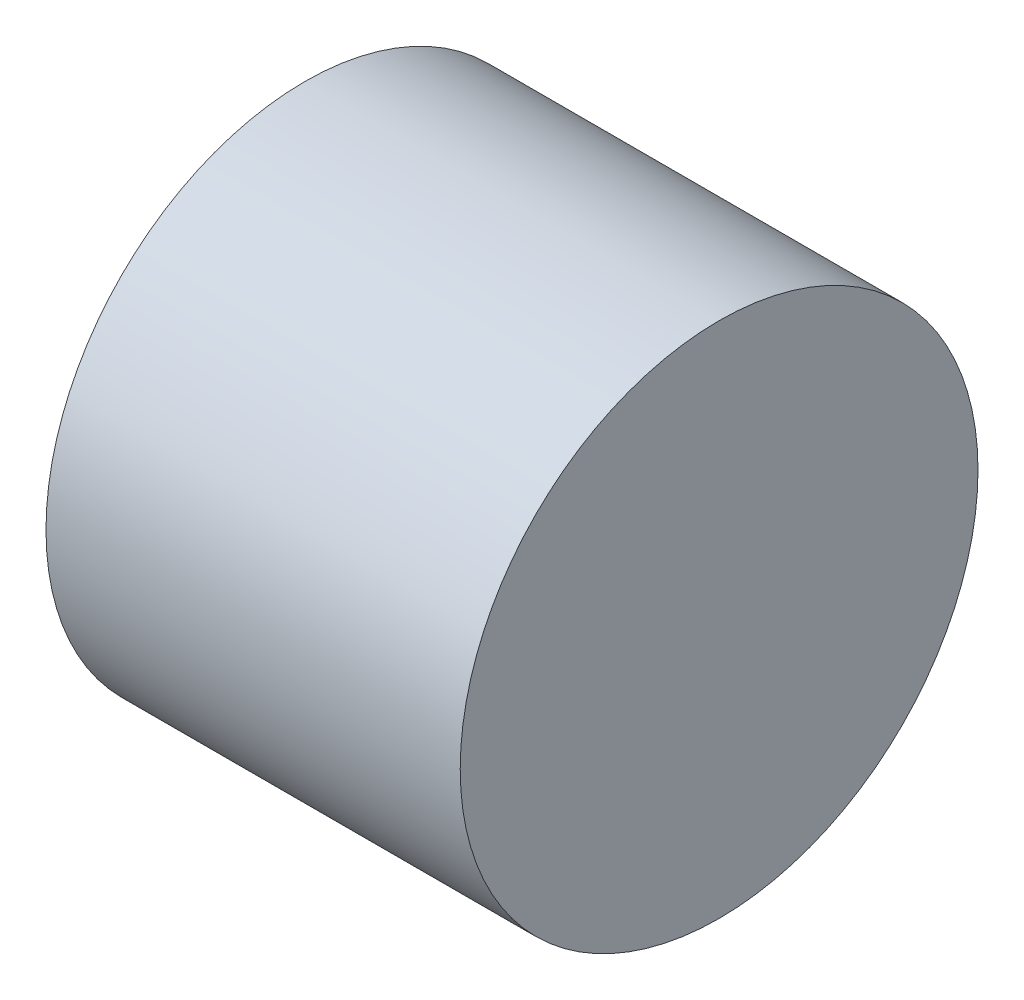
from build123d import *

# Parameters (mm, degrees)
SKIZZE2_R                       = 100
AUFSATZ_LINEAR_AUSTRAGEN1_DEPTH = 160


with BuildPart() as part:
    # Skizze2 → Aufsatz-Linear austragen1 (new body)
    with BuildSketch(Plane(origin=(0, 0, 0), x_dir=(0, 0, -1), z_dir=(1, 0, 0))):
        Circle(SKIZZE2_R)
    extrude(amount=AUFSATZ_LINEAR_AUSTRAGEN1_DEPTH)


solid = part.part
